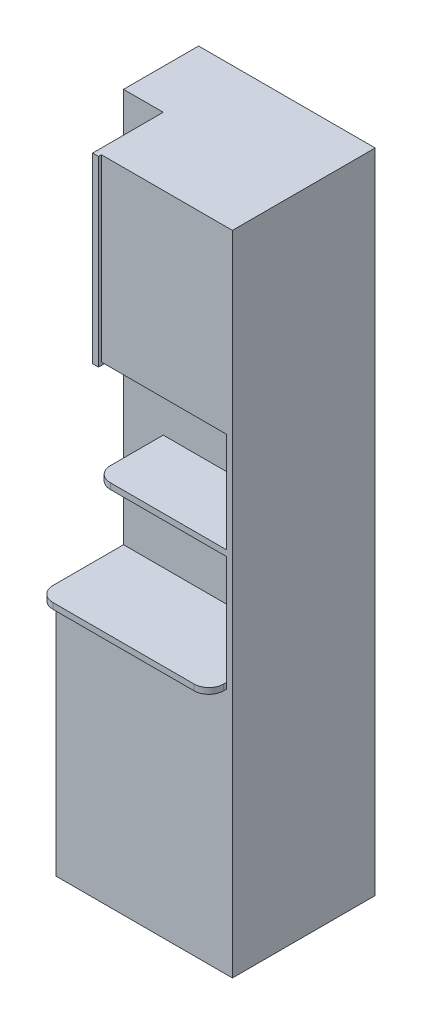
from build123d import *

# Parameters (mm, degrees)
SKETCH_1_W          = 0.6
SKETCH_1_H          = 2.2
EXTRUDE_1_DEPTH     = 0.485
SKETCH_2_W          = 0.23
SKETCH_2_H          = 1.36
CUT_EXTRUDE_1_DEPTH = 0.135
SKETCH_3_W          = 0.23
SKETCH_3_H          = 0.39
CUT_EXTRUDE_2_DEPTH = 0.445
SKETCH_4_W          = 0.23
SKETCH_4_H          = 0.34
CUT_EXTRUDE_3_DEPTH = 0.445
SKETCH_6_W          = 0.23
SKETCH_6_H          = 0.61
CUT_EXTRUDE_4_DEPTH = 0.02
SKETCH_7_W          = 0.24
SKETCH_7_H          = 0.62
EXTRUDE_2_DEPTH     = 0.02
SKETCH_8_W          = 0.58
SKETCH_8_H          = 0.29
EXTRUDE_3_DEPTH     = 0.02
FILLET_1_R          = 0.05
FILLET_2_R          = 0.05
FILLET_3_R          = 0.05


with BuildPart() as part:
    # 스케치1 → 보스-돌출1 (new body)
    with BuildSketch(Plane.XY):
        Rectangle(SKETCH_1_W, SKETCH_1_H)
    extrude(amount=EXTRUDE_1_DEPTH)

    # 스케치2 → 컷-돌출1 (cut)
    with BuildSketch(Plane.ZY.offset(0.3)):
        with Locations((0.37, 0.42)):
            Rectangle(SKETCH_2_W, SKETCH_2_H)
    extrude(amount=-CUT_EXTRUDE_1_DEPTH, mode=Mode.SUBTRACT)

    # 스케치3 → 컷-돌출2 (cut)
    with BuildSketch(Plane.ZY.offset(0.165)):
        with Locations((0.37, -0.065)):
            Rectangle(SKETCH_3_W, SKETCH_3_H)
    extrude(amount=-CUT_EXTRUDE_2_DEPTH, mode=Mode.SUBTRACT)

    # 스케치4 → 컷-돌출3 (cut)
    with BuildSketch(Plane.ZY.offset(0.165)):
        with Locations((0.37, 0.32)):
            Rectangle(SKETCH_4_W, SKETCH_4_H)
    extrude(amount=-CUT_EXTRUDE_3_DEPTH, mode=Mode.SUBTRACT)

    # 스케치6 → 컷-돌출4 (cut)
    with BuildSketch(Plane.ZY.offset(0.165)):
        with Locations((0.37, 0.795)):
            Rectangle(SKETCH_6_W, SKETCH_6_H)
    extrude(amount=-CUT_EXTRUDE_4_DEPTH, mode=Mode.SUBTRACT)

    # 스케치7 → 보스-돌출2 (add)
    with BuildSketch(Plane.ZY.offset(0.145)):
        with Locations((0.375, 0.79)):
            Rectangle(SKETCH_7_W, SKETCH_7_H)
    extrude(amount=EXTRUDE_2_DEPTH)

    # 스케치8 → 보스-돌출3 (add)
    with BuildSketch(Plane(origin=(0, -0.26, 0), x_dir=(1, 0, 0), z_dir=(0, 1, 0))):
        with Locations((-0.01, -0.4)):
            Rectangle(SKETCH_8_W, SKETCH_8_H)
    extrude(amount=EXTRUDE_3_DEPTH)

    # 필렛1
    fillet_1_edges = [part.edges().sort_by_distance(p)[0] for p in [
        (-0.3, -0.25, 0.545),
    ]]
    fillet(fillet_1_edges, radius=FILLET_1_R)

    # 필렛2
    fillet_2_edges = [part.edges().sort_by_distance(p)[0] for p in [
        (-0.165, 0.14, 0.485),
    ]]
    fillet(fillet_2_edges, radius=FILLET_2_R)

    # 필렛3
    fillet_3_edges = [part.edges().sort_by_distance(p)[0] for p in [
        (0.28, -0.25, 0.545),
    ]]
    fillet(fillet_3_edges, radius=FILLET_3_R)


solid = part.part
